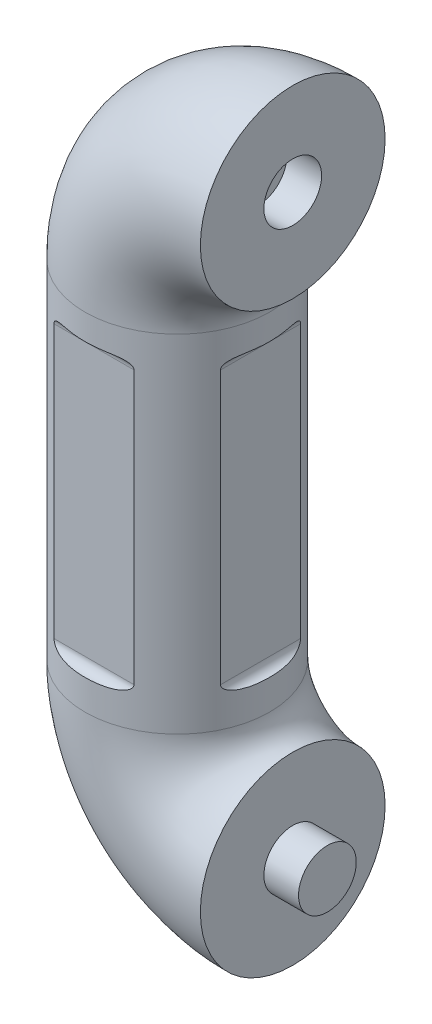
from build123d import *

# Parameters (mm, degrees)
SWEEP1_PROFILE_R    = 80
SKETCH6_R           = 25
CUT_EXTRUDE1_DEPTH  = 30
SKETCH7_R           = 25
BOSS_EXTRUDE1_DEPTH = 30
CUT_EXTRUDE2_START  = -100
SKETCH8_R           = 50
SKETCH8_R_2         = 45
SKETCH8_R_3         = 35
SKETCH8_R_4         = 25
CUT_EXTRUDE2_DEPTH  = 513.535713382
CUT_EXTRUDE3_DEPTH  = 616.548535999
CIRPATTERN1_COUNT   = 4


with BuildPart() as part:
    # Sweep1: sweep along a path in Sketch1
    with BuildLine(Plane.XY) as sweep1_path:
        ThreePointArc((-10, 500), (-80.710678119, 470.710678119), (-110, 400))
        Line((-110, 400), (-110, 100))
        ThreePointArc((-110, 100), (-80.710678119, 29.289321881), (-10, 0))
    # Sweep1 profile (on start of the path) → Sweep1 (sweep)
    with BuildSketch(Plane(origin=(-10, 500, 0), x_dir=(0, -1, 0), z_dir=(-1, 0, 0))):
        Circle(SWEEP1_PROFILE_R)
    sweep(path=sweep1_path.line)

    # Sketch6 → Cut-Extrude1 (cut)
    with BuildSketch(Plane(origin=(-10, 0, 0), x_dir=(0, 0, -1), z_dir=(1, 0, 0))):
        with Locations(Location((0, 500, 0), (0, 0, 90))):
            Circle(SKETCH6_R)
    extrude(amount=-CUT_EXTRUDE1_DEPTH, mode=Mode.SUBTRACT)

    # Sketch7 → Boss-Extrude1 (add)
    with BuildSketch(Plane(origin=(-10, 0, 0), x_dir=(0, 0, -1), z_dir=(1, 0, 0))):
        with Locations(Location((0, 0, 0), (0, 0, 90))):
            Circle(SKETCH7_R)
    extrude(amount=BOSS_EXTRUDE1_DEPTH)

    # Sketch8 → Cut-Extrude2 (cut, through all)
    # profile 1 of 2: a face of its own
    with BuildSketch(Plane(origin=(-10, 0, 0), x_dir=(0, 0, -1), z_dir=(1, 0, 0)).offset(CUT_EXTRUDE2_START)):
        Circle(SKETCH8_R)
        with Locations(Location((0, 0, 0), (0, 0, 90))):
            Circle(SKETCH8_R_2, mode=Mode.SUBTRACT)
    # profile 2 of 2: a face of its own
    with BuildSketch(Plane(origin=(-10, 0, 0), x_dir=(0, 0, -1), z_dir=(1, 0, 0)).offset(CUT_EXTRUDE2_START)):
        with Locations(Location((0, 0, 0), (0, 0, 90))):
            Circle(SKETCH8_R_3)
        with Locations(Location((0, 0, 0), (0, 0, 90))):
            Circle(SKETCH8_R_4, mode=Mode.SUBTRACT)
    extrude(amount=-CUT_EXTRUDE2_DEPTH, mode=Mode.SUBTRACT)

    # Sketch9 → Cut-Extrude3 (cut, symmetric)
    with BuildSketch(Plane.XY):
        with BuildLine():
            Line((-182.109789054, 370), (-182.109789054, 133.943692936))
            ThreePointArc((-182.109789054, 133.943692936), (-190, 126.053481991), (-197.890210946, 133.943692936))
            Line((-197.890210946, 133.943692936), (-197.890210946, 370))
            ThreePointArc((-197.890210946, 370), (-190, 377.890210946), (-182.109789054, 370))
        make_face()
    cut_extrude3 = extrude(amount=CUT_EXTRUDE3_DEPTH, both=True, mode=Mode.SUBTRACT)

    # CirPattern1: Cut-Extrude3 ×4 about axis
    cirpattern1_axis = Axis((-110, 0, 0), (0, 1, 0))
    for i in range(1, CIRPATTERN1_COUNT):
        add(cut_extrude3.rotate(cirpattern1_axis, i * 360 / CIRPATTERN1_COUNT), mode=Mode.SUBTRACT)


solid = part.part
